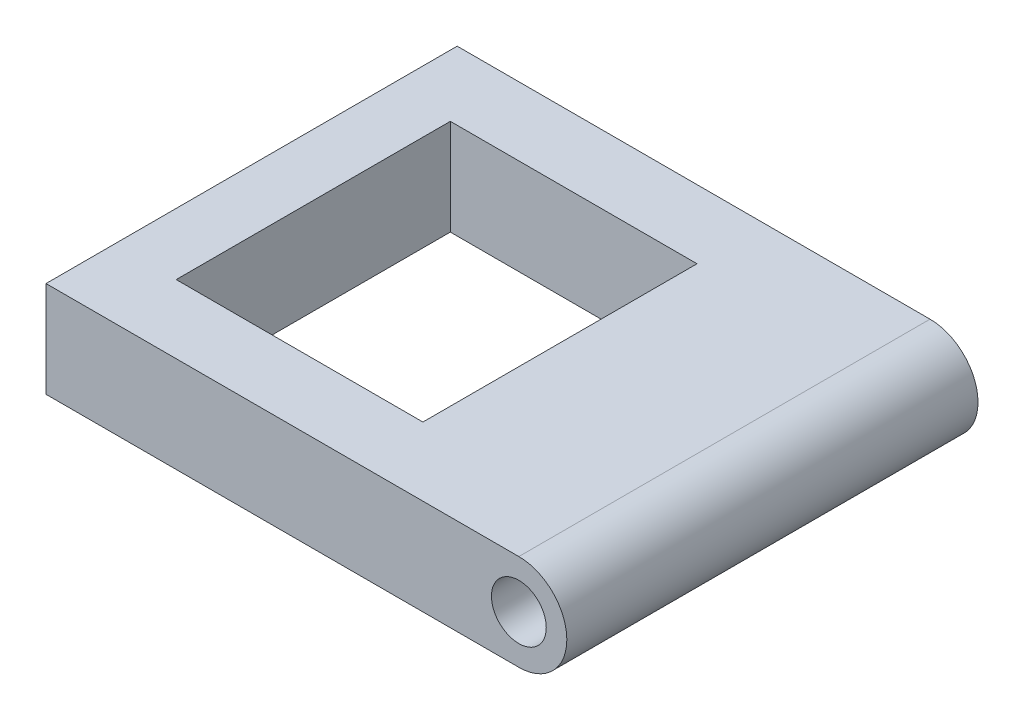
from build123d import *

# Parameters (mm, degrees)
SKETCH_1_W      = 55
SKETCH_1_H      = 60
SKETCH_1_W_2    = 36
SKETCH_1_H_2    = 40
EXTRUDE_1_DEPTH = 14
SKETCH_2_R      = 4
EXTRUDE_2_DEPTH = 60


with BuildPart() as part:
    # 草图1 → 凸台-拉伸1 (new body)
    with BuildSketch(Plane(origin=(0, 0, 0), x_dir=(1, 0, 0), z_dir=(0, 1, 0))):
        with Locations((27.5, 30)):
            Rectangle(SKETCH_1_W, SKETCH_1_H)
        with Locations((27, 30)):
            Rectangle(SKETCH_1_W_2, SKETCH_1_H_2, mode=Mode.SUBTRACT)
    extrude(amount=EXTRUDE_1_DEPTH)

    # 草图2 → 凸台-拉伸2 (add)
    with BuildSketch(Plane.XY):
        with BuildLine():
            Line((55, 14), (69, 14))
            ThreePointArc((69, 14), (76, 7), (69, 0))
            Line((69, 0), (55, 0))
            Line((55, 0), (55, 14))
        make_face()
        with Locations((69, 7)):
            Circle(SKETCH_2_R, mode=Mode.SUBTRACT)
    extrude(amount=-EXTRUDE_2_DEPTH)


solid = part.part
